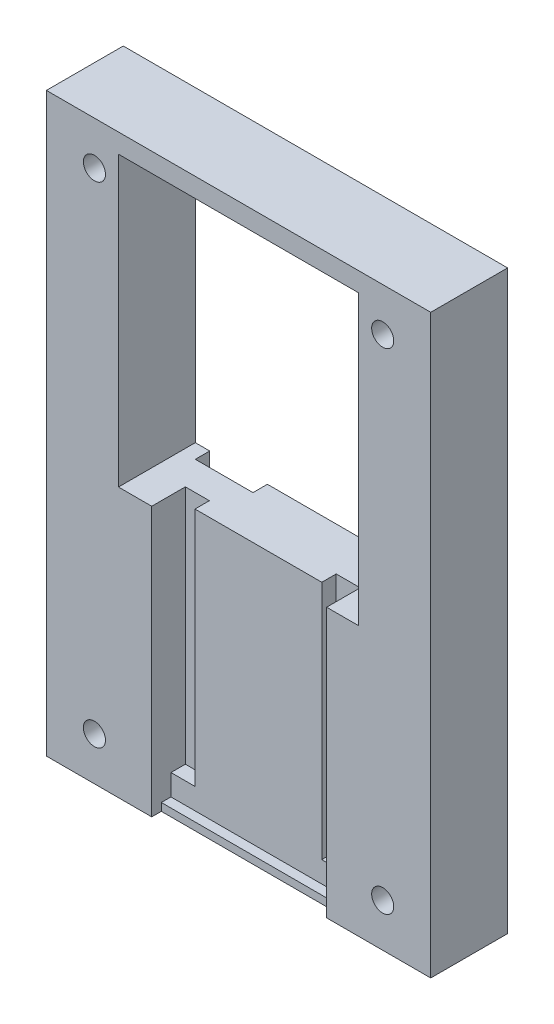
from build123d import *

# Parameters (mm, degrees)
SKETCH1_W           = 60
SKETCH1_H           = 40
BOSS_EXTRUDE1_DEPTH = 8
SKETCH3_R           = 1.15
CUT_EXTRUDE2_DEPTH  = 73.553428589
SKETCH7_W           = 25
SKETCH7_H           = 30
CUT_EXTRUDE6_DEPTH  = 73.553428589
SKETCH8_W           = 18.2
SKETCH8_H           = 45
CUT_EXTRUDE7_DEPTH  = 2
SKETCH9_W           = 2.5
SKETCH9_H           = 25
CUT_EXTRUDE8_DEPTH  = 1.5
SKETCH10_W          = 18.2
SKETCH10_H          = 0.8
BOSS_EXTRUDE2_DEPTH = 1
SKETCH11_W          = 5
SKETCH11_H          = 3
SKETCH11_W_2        = 6
SKETCH11_H_2        = 11
CUT_EXTRUDE9_DEPTH  = 1.5


with BuildPart() as part:
    # Sketch1 → Boss-Extrude1 (new body)
    with BuildSketch(Plane(origin=(0, 0, 0), x_dir=(0, 1, 0), z_dir=(0, 0, 1))):
        with Locations((30, -20)):
            Rectangle(SKETCH1_W, SKETCH1_H)
    extrude(amount=BOSS_EXTRUDE1_DEPTH)

    # Sketch3 → Cut-Extrude2 (cut, through all)
    with BuildSketch(Plane.XY.offset(8)):
        with Locations((5, 4.5)):
            Circle(SKETCH3_R)
        with Locations((35, 4.5)):
            Circle(SKETCH3_R)
        with Locations((5, 55.5)):
            Circle(SKETCH3_R)
        with Locations((35, 55.5)):
            Circle(SKETCH3_R)
    extrude(amount=-CUT_EXTRUDE2_DEPTH, mode=Mode.SUBTRACT)

    # Sketch7 → Cut-Extrude6 (cut, through all)
    with BuildSketch(Plane.XY.offset(8)):
        with Locations((20, 43)):
            Rectangle(SKETCH7_W, SKETCH7_H)
    extrude(amount=-CUT_EXTRUDE6_DEPTH, mode=Mode.SUBTRACT)

    # Sketch8 → Cut-Extrude7 (cut)
    with BuildSketch(Plane.XY.offset(8)):
        with Locations((20.062509857, 22.5)):
            Rectangle(SKETCH8_W, SKETCH8_H)
    extrude(amount=-CUT_EXTRUDE7_DEPTH, mode=Mode.SUBTRACT)

    # Sketch9 → Cut-Extrude8 (cut)
    with BuildSketch(Plane.XY.offset(6)):
        with Locations((12.212509857, 15.5)):
            Rectangle(SKETCH9_W, SKETCH9_H)
        with Locations((27.912509857, 15.5)):
            Rectangle(SKETCH9_W, SKETCH9_H)
    extrude(amount=-CUT_EXTRUDE8_DEPTH, mode=Mode.SUBTRACT)

    # Sketch10 → Boss-Extrude2 (add)
    with BuildSketch(Plane.XY.offset(6)):
        with Locations((20.062509857, 0.4)):
            Rectangle(SKETCH10_W, SKETCH10_H)
    extrude(amount=BOSS_EXTRUDE2_DEPTH)

    # Sketch11 → Cut-Extrude9 (cut)
    with BuildSketch(Plane(origin=(0, 0, 0), x_dir=(1, 0, 0), z_dir=(0, 0, -1))):
        with Locations((23.5, -22.4)):
            Rectangle(SKETCH11_W, SKETCH11_H)
        with Locations((12, -28.5)):
            Rectangle(SKETCH11_W_2, SKETCH11_H_2)
    extrude(amount=-CUT_EXTRUDE9_DEPTH, mode=Mode.SUBTRACT)


solid = part.part
